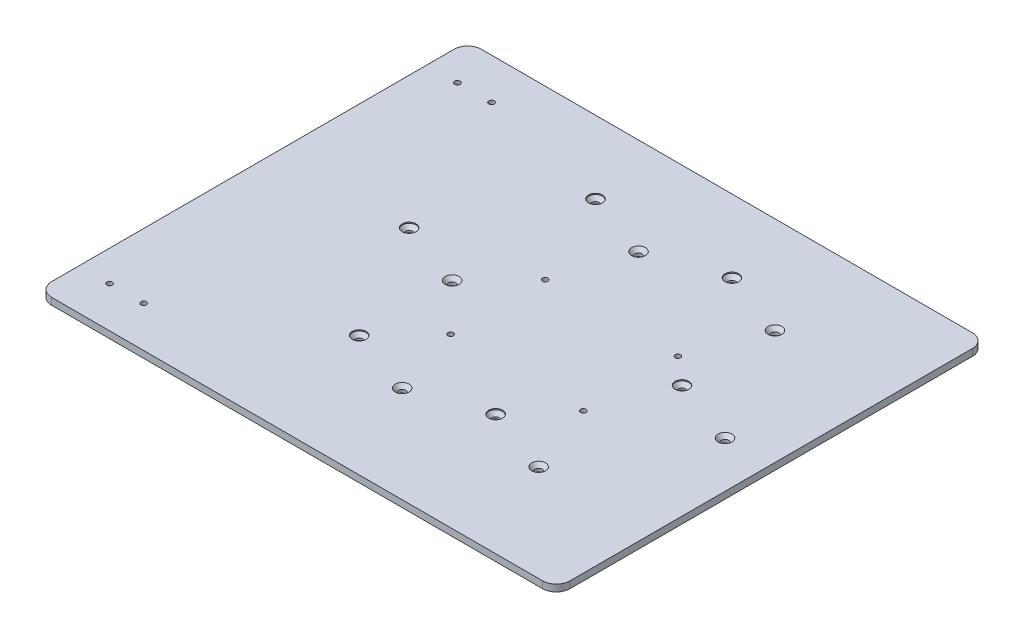
from build123d import *

# Parameters (mm, degrees)
SKETCH1_W                                       = 500
SKETCH1_H                                       = 400
BOSS_EXTRUDE1_DEPTH                             = 6.35
CSK_FOR_1_4_FLAT_HEAD_MACHINE_SCREW1_AT_COUNT   = 2
CSK_FOR_1_4_FLAT_HEAD_MACHINE_SCREW1_AT_PITCH   = 127
CSK_FOR_1_4_FLAT_HEAD_MACHINE_SCREW1_2_COUNT    = 2
CSK_FOR_1_4_FLAT_HEAD_MACHINE_SCREW1_2_PITCH    = 219.970452561
CSK_FOR_1_4_FLAT_HEAD_MACHINE_SCREW1_3_COUNT    = 2
CSK_FOR_1_4_FLAT_HEAD_MACHINE_SCREW1_3_PITCH    = 254
CSK_FOR_1_4_FLAT_HEAD_MACHINE_SCREW1_4_COUNT    = 2
CSK_FOR_1_4_FLAT_HEAD_MACHINE_SCREW1_4_PITCH    = 219.970452561
CSK_FOR_1_4_FLAT_HEAD_MACHINE_SCREW1_5_COUNT    = 2
CSK_FOR_1_4_FLAT_HEAD_MACHINE_SCREW1_5_PITCH    = 127
CSK_FOR_10_FLAT_HEAD_MACHINE_SCREW1_D           = 5.1054
CSK_FOR_10_FLAT_HEAD_MACHINE_SCREW1_CSINK_D     = 9.779
CSK_FOR_10_FLAT_HEAD_MACHINE_SCREW1_CSINK_ANGLE = 82
SKETCH12_W                                      = 500
SKETCH12_H                                      = 22.479
CUT_EXTRUDE2_DEPTH                              = 6.35
SKETCH13_W                                      = 500
SKETCH13_H                                      = 22.479
BOSS_EXTRUDE2_DEPTH                             = 6.35
CSK_FOR_10_FLAT_HEAD_MACHINE_SCREW2_D           = 5.1054
CSK_FOR_10_FLAT_HEAD_MACHINE_SCREW2_CSINK_D     = 9.779
CSK_FOR_10_FLAT_HEAD_MACHINE_SCREW2_CSINK_ANGLE = 82
SKETCH22_W                                      = 17.526
SKETCH22_H                                      = 400
CUT_EXTRUDE4_DEPTH                              = 10
FILLET1_R                                       = 12.7
CSK_FOR_1_4_FLAT_HEAD_MACHINE_SCREW2_AT_COUNT   = 2
CSK_FOR_1_4_FLAT_HEAD_MACHINE_SCREW2_AT_PITCH   = 127
CSK_FOR_1_4_FLAT_HEAD_MACHINE_SCREW2_2_COUNT    = 2
CSK_FOR_1_4_FLAT_HEAD_MACHINE_SCREW2_2_PITCH    = 219.970452561
CSK_FOR_1_4_FLAT_HEAD_MACHINE_SCREW2_3_COUNT    = 2
CSK_FOR_1_4_FLAT_HEAD_MACHINE_SCREW2_3_PITCH    = 254
CSK_FOR_1_4_FLAT_HEAD_MACHINE_SCREW2_4_COUNT    = 2
CSK_FOR_1_4_FLAT_HEAD_MACHINE_SCREW2_4_PITCH    = 219.970452561
CSK_FOR_1_4_FLAT_HEAD_MACHINE_SCREW2_5_COUNT    = 2
CSK_FOR_1_4_FLAT_HEAD_MACHINE_SCREW2_5_PITCH    = 127


with BuildPart() as part:
    # Sketch1 → Boss-Extrude1 (new body)
    with BuildSketch(Plane(origin=(0, 0, 0), x_dir=(1, 0, 0), z_dir=(0, 1, 0))):
        with Locations((250, 200)):
            Rectangle(SKETCH1_W, SKETCH1_H)
    extrude(amount=BOSS_EXTRUDE1_DEPTH)

    # Sketch3 → CSK for 1/4 Flat Head Machine Screw1 (revolve, cut)
    with BuildSketch(Plane(origin=(313.5, 6.35, -309.985226281), x_dir=(0, 0, 1), z_dir=(1, 0, 0))):
        Polygon((0, 0), (0, 6.35), (3.3782, 6.35), (3.3782, 4.520932584), (6.4389, 1), (6.4389, 0), align=None)
    csk_for_1_4_flat_head_machine_screw1 = revolve(axis=Axis((313.5, 12.7, -309.985226281), (0, -1, 0)), mode=Mode.SUBTRACT)

    # CSK for 1/4 Flat Head Machine Screw1 at: CSK for 1/4 Flat Head Machine Screw1 ×2
    with Locations(*[(-i * CSK_FOR_1_4_FLAT_HEAD_MACHINE_SCREW1_AT_PITCH, 0, 0) for i in range(1, CSK_FOR_1_4_FLAT_HEAD_MACHINE_SCREW1_AT_COUNT)]):
        add(csk_for_1_4_flat_head_machine_screw1, mode=Mode.SUBTRACT)

    # CSK for 1_4 Flat Head Machine Screw1 2: CSK for 1/4 Flat Head Machine Screw1 ×2
    with Locations(*[Vector(-0.866025403784438, 0, 0.5000000000000012) * (i * CSK_FOR_1_4_FLAT_HEAD_MACHINE_SCREW1_2_PITCH) for i in range(1, CSK_FOR_1_4_FLAT_HEAD_MACHINE_SCREW1_2_COUNT)]):
        add(csk_for_1_4_flat_head_machine_screw1, mode=Mode.SUBTRACT)

    # CSK for 1_4 Flat Head Machine Screw1 3: CSK for 1/4 Flat Head Machine Screw1 ×2
    with Locations(*[Vector(-0.49999999999999767, 0, 0.86602540378444) * (i * CSK_FOR_1_4_FLAT_HEAD_MACHINE_SCREW1_3_PITCH) for i in range(1, CSK_FOR_1_4_FLAT_HEAD_MACHINE_SCREW1_3_COUNT)]):
        add(csk_for_1_4_flat_head_machine_screw1, mode=Mode.SUBTRACT)

    # CSK for 1_4 Flat Head Machine Screw1 4: CSK for 1/4 Flat Head Machine Screw1 ×2
    with Locations(*[(0, 0, i * CSK_FOR_1_4_FLAT_HEAD_MACHINE_SCREW1_4_PITCH) for i in range(1, CSK_FOR_1_4_FLAT_HEAD_MACHINE_SCREW1_4_COUNT)]):
        add(csk_for_1_4_flat_head_machine_screw1, mode=Mode.SUBTRACT)

    # CSK for 1_4 Flat Head Machine Screw1 5: CSK for 1/4 Flat Head Machine Screw1 ×2
    with Locations(*[Vector(0.500000000000001, 0, 0.866025403784438) * (i * CSK_FOR_1_4_FLAT_HEAD_MACHINE_SCREW1_5_PITCH) for i in range(1, CSK_FOR_1_4_FLAT_HEAD_MACHINE_SCREW1_5_COUNT)]):
        add(csk_for_1_4_flat_head_machine_screw1, mode=Mode.SUBTRACT)

    # CSK for #10 Flat Head Machine Screw1 (through all)
    with Locations(Plane(origin=(351.616, 0, -133.475), x_dir=(0, 0, -1), z_dir=(0, -1, 0))):
        with Locations((0, 0), (88, 0), (88, -123.444), (0, -123.444)):
            CounterSinkHole(CSK_FOR_10_FLAT_HEAD_MACHINE_SCREW1_D / 2, CSK_FOR_10_FLAT_HEAD_MACHINE_SCREW1_CSINK_D / 2, counter_sink_angle=CSK_FOR_10_FLAT_HEAD_MACHINE_SCREW1_CSINK_ANGLE)

    # Sketch12 → Cut-Extrude2 (cut)
    with BuildSketch(Plane(origin=(0, 6.35, 0), x_dir=(1, 0, 0), z_dir=(0, 1, 0))):
        with Locations((250, 388.7605)):
            Rectangle(SKETCH12_W, SKETCH12_H)
    extrude(amount=-CUT_EXTRUDE2_DEPTH, mode=Mode.SUBTRACT)

    # Sketch13 → Boss-Extrude2 (add)
    with BuildSketch(Plane(origin=(0, 6.35, 0), x_dir=(1, 0, 0), z_dir=(0, 1, 0))):
        with Locations((250, -11.2395)):
            Rectangle(SKETCH13_W, SKETCH13_H)
    extrude(amount=-BOSS_EXTRUDE2_DEPTH)

    # CSK for #10 Flat Head Machine Screw2 (through all)
    with Locations(Plane(origin=(60.325, 0, -15.621), x_dir=(0, 0, -1), z_dir=(0, -1, 0))):
        with Locations((0, 0), (0, -31.75), (323.8, 0), (323.8, -31.75)):
            CounterSinkHole(CSK_FOR_10_FLAT_HEAD_MACHINE_SCREW2_D / 2, CSK_FOR_10_FLAT_HEAD_MACHINE_SCREW2_CSINK_D / 2, counter_sink_angle=CSK_FOR_10_FLAT_HEAD_MACHINE_SCREW2_CSINK_ANGLE)

    # Sketch22 → Cut-Extrude4 (cut)
    with BuildSketch(Plane(origin=(0, 6.35, 0), x_dir=(1, 0, 0), z_dir=(0, 1, 0))):
        with Locations((491.237, 177.521)):
            Rectangle(SKETCH22_W, SKETCH22_H)
    extrude(amount=-CUT_EXTRUDE4_DEPTH, mode=Mode.SUBTRACT)

    # Fillet1
    fillet1_edges = [part.edges().sort_by_distance(p)[0] for p in [
        (0, 3.175, 22.479),
        (482.474, 3.175, 22.479),
        (482.474, 3.175, -377.521),
        (0, 3.175, -377.521),
    ]]
    fillet(fillet1_edges, radius=FILLET1_R)

    # Sketch28 → CSK for 1/4 Flat Head Machine Screw2 (revolve, cut)
    with BuildSketch(Plane(origin=(249, 6.35, -287.518226281), x_dir=(0, 0, 1), z_dir=(1, 0, 0))):
        Polygon((0, 0), (0, 6.35), (3.3782, 6.35), (3.3782, 3.520932584), (6.4389, 0), align=None)
    csk_for_1_4_flat_head_machine_screw2 = revolve(axis=Axis((249, 12.7, -287.518226281), (0, -1, 0)), mode=Mode.SUBTRACT)

    # CSK for 1/4 Flat Head Machine Screw2 at: CSK for 1/4 Flat Head Machine Screw2 ×2
    with Locations(*[(i * CSK_FOR_1_4_FLAT_HEAD_MACHINE_SCREW2_AT_PITCH, 0, 0) for i in range(1, CSK_FOR_1_4_FLAT_HEAD_MACHINE_SCREW2_AT_COUNT)]):
        add(csk_for_1_4_flat_head_machine_screw2, mode=Mode.SUBTRACT)

    # CSK for 1_4 Flat Head Machine Screw2 2: CSK for 1/4 Flat Head Machine Screw2 ×2
    with Locations(*[Vector(0.8660254037844398, 0, 0.49999999999999795) * (i * CSK_FOR_1_4_FLAT_HEAD_MACHINE_SCREW2_2_PITCH) for i in range(1, CSK_FOR_1_4_FLAT_HEAD_MACHINE_SCREW2_2_COUNT)]):
        add(csk_for_1_4_flat_head_machine_screw2, mode=Mode.SUBTRACT)

    # CSK for 1_4 Flat Head Machine Screw2 3: CSK for 1/4 Flat Head Machine Screw2 ×2
    with Locations(*[Vector(0.5000000000000043, 0, 0.8660254037844363) * (i * CSK_FOR_1_4_FLAT_HEAD_MACHINE_SCREW2_3_PITCH) for i in range(1, CSK_FOR_1_4_FLAT_HEAD_MACHINE_SCREW2_3_COUNT)]):
        add(csk_for_1_4_flat_head_machine_screw2, mode=Mode.SUBTRACT)

    # CSK for 1_4 Flat Head Machine Screw2 4: CSK for 1/4 Flat Head Machine Screw2 ×2
    with Locations(*[(0, 0, i * CSK_FOR_1_4_FLAT_HEAD_MACHINE_SCREW2_4_PITCH) for i in range(1, CSK_FOR_1_4_FLAT_HEAD_MACHINE_SCREW2_4_COUNT)]):
        add(csk_for_1_4_flat_head_machine_screw2, mode=Mode.SUBTRACT)

    # CSK for 1_4 Flat Head Machine Screw2 5: CSK for 1/4 Flat Head Machine Screw2 ×2
    with Locations(*[Vector(-0.4999999999999978, 0, 0.86602540378444) * (i * CSK_FOR_1_4_FLAT_HEAD_MACHINE_SCREW2_5_PITCH) for i in range(1, CSK_FOR_1_4_FLAT_HEAD_MACHINE_SCREW2_5_COUNT)]):
        add(csk_for_1_4_flat_head_machine_screw2, mode=Mode.SUBTRACT)


solid = part.part
